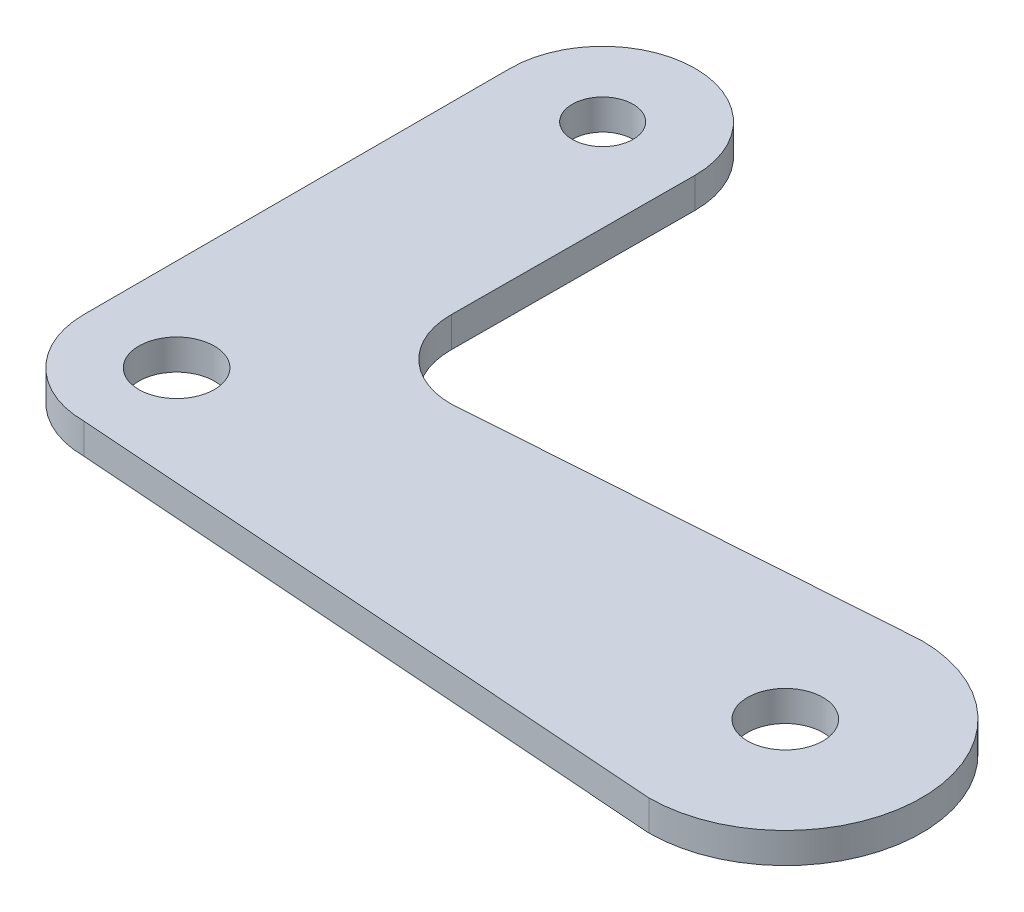
from build123d import *

# Parameters (mm, degrees)
SKETCH1_R           = 3.937
SKETCH1_R_2         = 3.175
BOSS_EXTRUDE1_DEPTH = 3.175


with BuildPart() as part:
    # Sketch1 → Boss-Extrude1 (new body)
    with BuildSketch(Plane(origin=(0, 0, 0), x_dir=(1, 0, 0), z_dir=(0, 1, 0))):
        with BuildLine():
            ThreePointArc((-47.439743119, 21.70075638), (-57.091743119, 31.35275638), (-66.743743119, 21.70075638))
            Line((-66.743743119, 21.70075638), (-66.743743119, -22.74924362))
            ThreePointArc((-66.743743119, -22.74924362), (-63.916737771, -29.574238272), (-57.091743119, -32.40124362))
            Line((-57.091743119, -32.40124362), (4.370564279, -36.826529753))
            Line((4.370564279, -36.826529753), (6.408256881, -36.97324362))
            ThreePointArc((6.408256881, -36.97324362), (20.632256881, -22.74924362), (6.408256881, -8.52524362))
            Line((6.408256881, -8.52524362), (4.452941658, -8.660279201))
            Line((4.452941658, -8.660279201), (-38.465878307, -11.624286105))
            ThreePointArc((-38.465878307, -11.624286105), (-39.014500852, -11.681231653), (-39.565743119, -11.70024362))
            ThreePointArc((-39.565743119, -11.70024362), (-45.223304476, -9.356804976), (-47.566743119, -3.69924362))
            Line((-47.566743119, -3.69924362), (-47.566343079, -3.61923562))
            Line((-47.566343079, -3.61923562), (-47.440225707, 21.604238793))
            Line((-47.440225707, 21.604238793), (-47.439743119, 21.70075638))
        make_face()
        with Locations(Location((-57.091743119, -22.74924362, 0), (0, 0, 270))):
            Circle(SKETCH1_R, mode=Mode.SUBTRACT)
        with Locations(Location((6.408256881, -22.74924362, 0), (0, 0, 270))):
            Circle(SKETCH1_R, mode=Mode.SUBTRACT)
        with Locations(Location((-57.091743119, 21.70075638, 0), (0, 0, 270))):
            Circle(SKETCH1_R_2, mode=Mode.SUBTRACT)
    extrude(amount=-BOSS_EXTRUDE1_DEPTH)


solid = part.part
